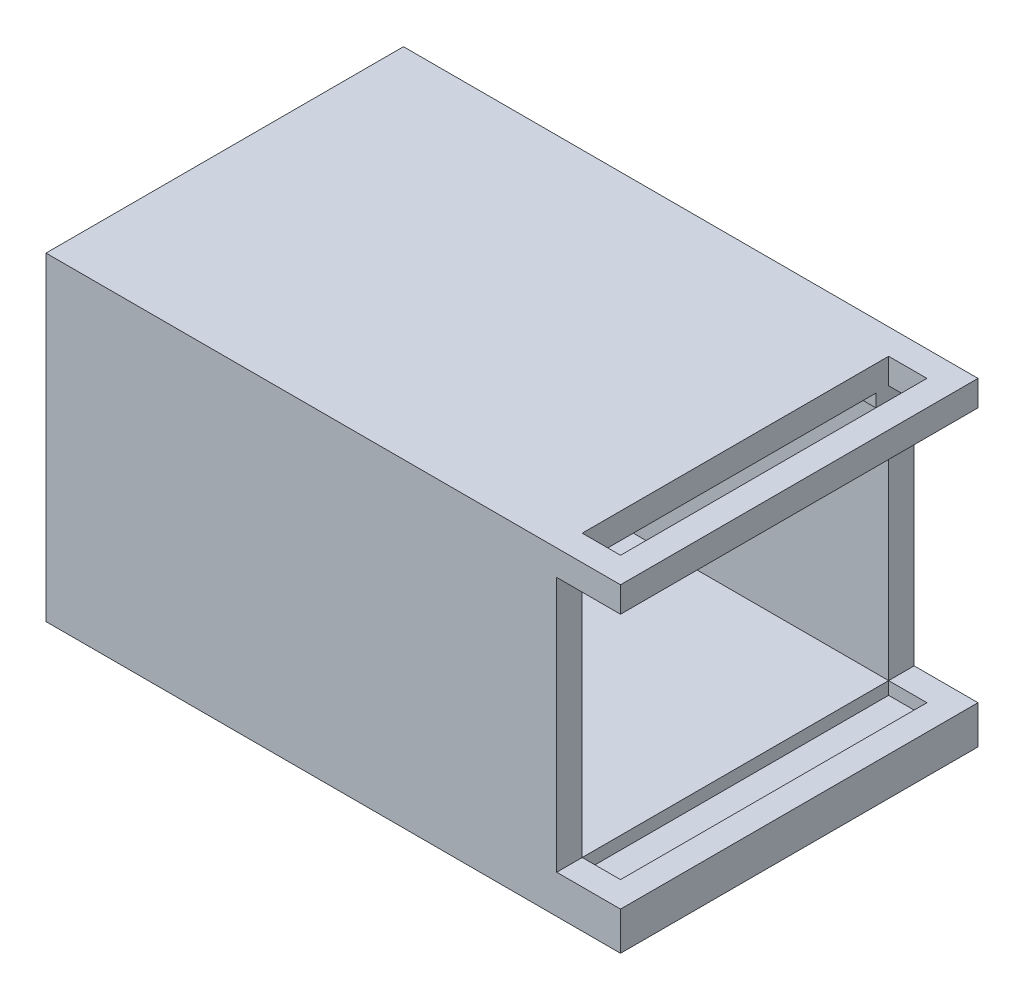
from build123d import *

# Parameters (mm, degrees)
SKETCH1_W           = 45
SKETCH1_H           = 28
BOSS_EXTRUDE1_DEPTH = 3
BOSS_EXTRUDE2_DEPTH = 22
SKETCH4_W           = 45
SKETCH4_H           = 28
SKETCH4_W_2         = 3
SKETCH4_H_2         = 24
BOSS_EXTRUDE4_DEPTH = 2
SKETCH5_W           = 8.5
SKETCH5_H           = 3.5
CUT_EXTRUDE1_DEPTH  = 2
BOSS_EXTRUDE6_DEPTH = 1
SKETCH8_W           = 3
SKETCH8_H           = 24
CUT_EXTRUDE2_DEPTH  = 1


with BuildPart() as part:
    # Sketch1 → Boss-Extrude1 (new body)
    with BuildSketch(Plane(origin=(0, 0, 0), x_dir=(1, 0, 0), z_dir=(0, 1, 0))):
        with Locations((22.5, 14)):
            Rectangle(SKETCH1_W, SKETCH1_H)
    extrude(amount=BOSS_EXTRUDE1_DEPTH)

    # Sketch2 → Boss-Extrude2 (add)
    with BuildSketch(Plane(origin=(0, 3, 0), x_dir=(1, 0, 0), z_dir=(0, 1, 0))):
        Polygon((40, 26), (40, 28), (0, 28), (0, 0), (40, 0), (40, 2), (2, 2), (2, 26), align=None)
    extrude(amount=BOSS_EXTRUDE2_DEPTH)

    # Sketch4 → Boss-Extrude4 (add)
    with BuildSketch(Plane(origin=(0, 25, 0), x_dir=(1, 0, 0), z_dir=(0, 1, 0))):
        with Locations((22.5, 14)):
            Rectangle(SKETCH4_W, SKETCH4_H)
        with Locations((41.5, 14)):
            Rectangle(SKETCH4_W_2, SKETCH4_H_2, mode=Mode.SUBTRACT)
    extrude(amount=-BOSS_EXTRUDE4_DEPTH)

    # Sketch5 → Cut-Extrude1 (cut)
    with BuildSketch(Plane.ZY):
        with BuildLine():
            Line((-18.47, 5.25), (-18.47, 5.96))
            ThreePointArc((-18.47, 5.96), (-18.103883476, 6.843883476), (-17.22, 7.21))
            Line((-17.22, 7.21), (-10.78, 7.21))
            ThreePointArc((-10.78, 7.21), (-9.896116524, 6.843883476), (-9.53, 5.96))
            Line((-9.53, 5.96), (-9.53, 5.25))
            ThreePointArc((-9.53, 5.25), (-9.896116524, 4.366116524), (-10.78, 4))
            Line((-10.78, 4), (-17.22, 4))
            ThreePointArc((-17.22, 4), (-18.103883476, 4.366116524), (-18.47, 5.25))
        make_face()
        with Locations((-14, 10.25)):
            Rectangle(SKETCH5_W, SKETCH5_H)
    extrude(amount=-CUT_EXTRUDE1_DEPTH, mode=Mode.SUBTRACT)

    # Sketch7 → Boss-Extrude6 (add)
    with BuildSketch(Plane.XZ.offset(-23)):
        Polygon((40, -25), (5, -25), (5, -3), (40, -3), (40, -2), (2, -2), (2, -26), (40, -26), align=None)
    extrude(amount=BOSS_EXTRUDE6_DEPTH)

    # Sketch8 → Cut-Extrude2 (cut)
    with BuildSketch(Plane(origin=(0, 3, 0), x_dir=(1, 0, 0), z_dir=(0, 1, 0))):
        with Locations((41.5, 14)):
            Rectangle(SKETCH8_W, SKETCH8_H)
    extrude(amount=-CUT_EXTRUDE2_DEPTH, mode=Mode.SUBTRACT)


solid = part.part
